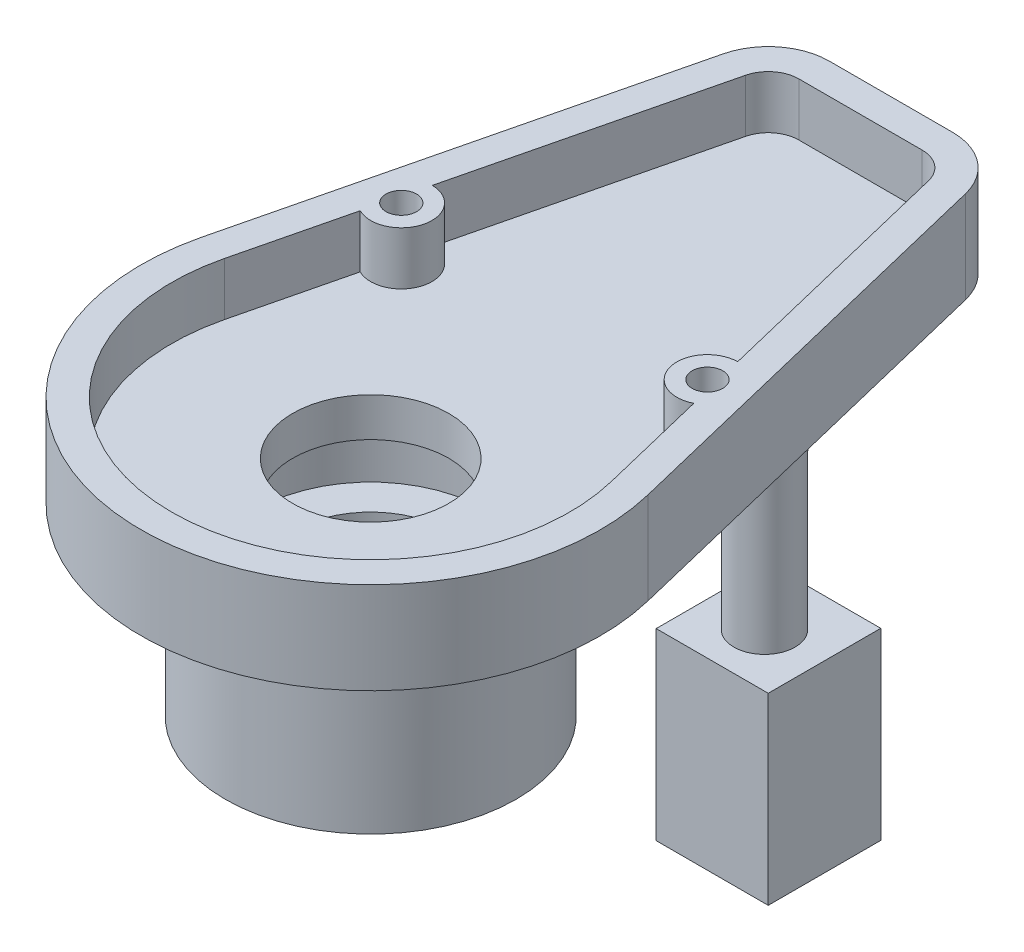
from build123d import *

# Parameters (mm, degrees)
SKETCH1_R           = 0.005
BOSS_EXTRUDE1_DEPTH = 0.03
SKETCH6_R           = 0.0255
BOSS_EXTRUDE5_DEPTH = 0.0127
SKETCH7_R           = 0.0475
SKETCH7_R_2         = 0.0375
BOSS_EXTRUDE6_DEPTH = 0.06
SKETCH8_R           = 0.0375
SKETCH8_R_2         = 0.0255
BOSS_EXTRUDE7_DEPTH = 0.02526
SKETCH9_R           = 0.01
BOSS_EXTRUDE8_DEPTH = 0.1
SKETCH10_W          = 0.036599462
SKETCH10_H          = 0.036757143
BOSS_EXTRUDE9_DEPTH = 0.06


with BuildPart() as part:
    # Sketch1 → Boss-Extrude1 (new body)
    with BuildSketch(Plane(origin=(0, 0, 0), x_dir=(1, 0, 0), z_dir=(0, 1, 0))):
        with BuildLine():
            Line((-0.039573681, 0.154724036), (-0.072877802, 0.017715135))
            ThreePointArc((-0.072877802, 0.017715135), (0, -0.075), (0.072877802, 0.017715135))
            Line((0.072877802, 0.017715135), (0.039573681, 0.154724036))
            ThreePointArc((0.039573681, 0.154724036), (0.032499197, 0.165723879), (0.0201396, 0.17))
            Line((0.0201396, 0.17), (-0.0201396, 0.17))
            ThreePointArc((-0.0201396, 0.17), (-0.032499197, 0.165723879), (-0.039573681, 0.154724036))
        make_face()
        with Locations(Location((-0.05, 0.06, 0), (0, 0, 270))):
            Circle(SKETCH1_R, mode=Mode.SUBTRACT)
        with Locations(Location((0.05, 0.06, 0), (0, 0, 270))):
            Circle(SKETCH1_R, mode=Mode.SUBTRACT)
        with BuildLine():
            Line((0.0201396, 0.16), (-0.0201396, 0.16))
            ThreePointArc((-0.0201396, 0.16), (-0.026319399, 0.157861939), (-0.029856641, 0.152362018))
            Line((-0.029856641, 0.152362018), (-0.049877381, 0.069999248))
            ThreePointArc((-0.049877381, 0.069999248), (-0.04028296, 0.057637982), (-0.054481083, 0.051060207))
            Line((-0.054481083, 0.051060207), (-0.063160762, 0.015353117))
            ThreePointArc((-0.063160762, 0.015353117), (0, -0.065), (0.063160762, 0.015353117))
            Line((0.063160762, 0.015353117), (0.054481083, 0.051060207))
            ThreePointArc((0.054481083, 0.051060207), (0.04028296, 0.057637982), (0.049877381, 0.069999248))
            Line((0.049877381, 0.069999248), (0.029856641, 0.152362018))
            ThreePointArc((0.029856641, 0.152362018), (0.026319399, 0.157861939), (0.0201396, 0.16))
        make_face(mode=Mode.SUBTRACT)
    extrude(amount=BOSS_EXTRUDE1_DEPTH)

    # Sketch6 → Boss-Extrude5 (add)
    with BuildSketch(Plane.XZ):
        with BuildLine():
            Line((-0.0201396, -0.17), (0.0201396, -0.17))
            ThreePointArc((0.0201396, -0.17), (0.032499197, -0.165723879), (0.039573681, -0.154724036))
            Line((0.039573681, -0.154724036), (0.072877802, -0.017715135))
            ThreePointArc((0.072877802, -0.017715135), (0, 0.075), (-0.072877802, -0.017715135))
            Line((-0.072877802, -0.017715135), (-0.039573681, -0.154724036))
            ThreePointArc((-0.039573681, -0.154724036), (-0.032499197, -0.165723879), (-0.0201396, -0.17))
        make_face()
        with Locations(Location((0, 0, 0), (0, 0, 270))):
            Circle(SKETCH6_R, mode=Mode.SUBTRACT)
    extrude(amount=-BOSS_EXTRUDE5_DEPTH)

    # Sketch7 → Boss-Extrude6 (add)
    with BuildSketch(Plane.XZ):
        with Locations(Location((0, 0, 0), (0, 0, 90))):
            Circle(SKETCH7_R)
        with Locations(Location((0, 0, 0), (0, 0, 270))):
            Circle(SKETCH7_R_2, mode=Mode.SUBTRACT)
    extrude(amount=BOSS_EXTRUDE6_DEPTH)

    # Sketch8 → Boss-Extrude7 (add)
    with BuildSketch(Plane(origin=(0, -0.0205, 0), x_dir=(-1, 0, 0), z_dir=(0, -1, 0))):
        with Locations(Location((0, 0, 0), (0, 0, 90))):
            Circle(SKETCH8_R)
        with Locations(Location((0, 0, 0), (0, 0, 90))):
            Circle(SKETCH8_R_2, mode=Mode.SUBTRACT)
    extrude(amount=BOSS_EXTRUDE7_DEPTH)

    # Sketch9 → Boss-Extrude8 (add)
    with BuildSketch(Plane.XZ):
        with Locations(Location((0, -0.128635749, 0), (0, 0, 90))):
            Circle(SKETCH9_R)
    extrude(amount=BOSS_EXTRUDE8_DEPTH)

    # Sketch10 → Boss-Extrude9 (add)
    with BuildSketch(Plane.XZ.offset(0.1)):
        with Locations((0.00036003, -0.129574617)):
            Rectangle(SKETCH10_W, SKETCH10_H)
    extrude(amount=BOSS_EXTRUDE9_DEPTH)


solid = part.part
